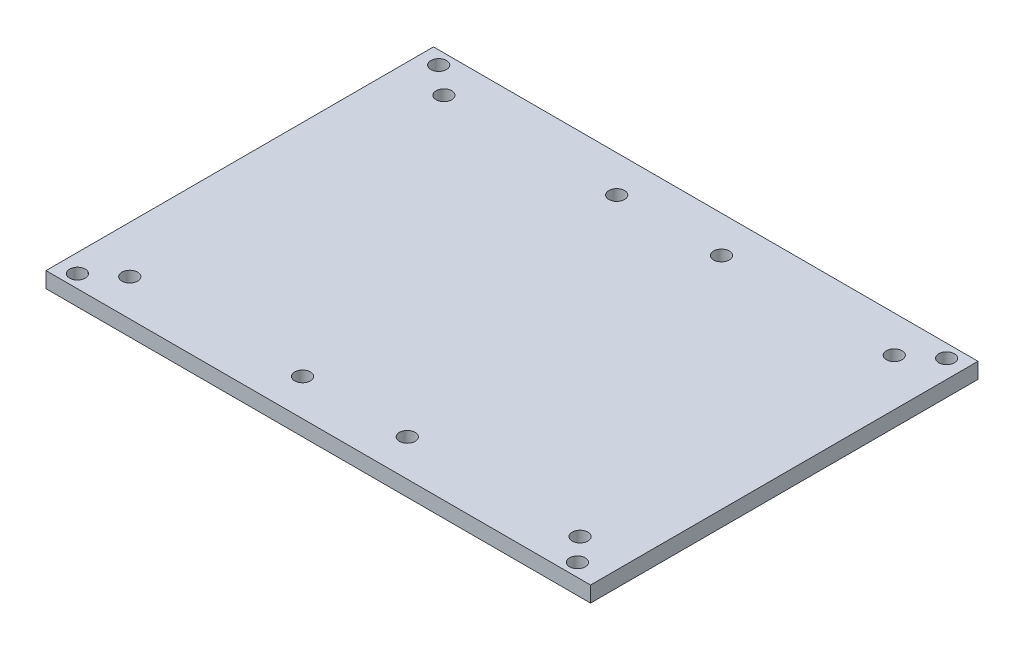
from build123d import *

# Parameters (mm, degrees)
SKETCH_1_W            = 104
SKETCH_1_H            = 74
EXTRUDE_203_DEPTH     = 3
SKETCH_2_R            = 1.5
CUT_EXTRUDE_441_DEPTH = 64.89053138


with BuildPart() as part:
    # 草图1 → Extrude 203 (new body)
    with BuildSketch(Plane(origin=(0, 0, 0), x_dir=(1, 0, 0), z_dir=(0, 1, 0))):
        Rectangle(SKETCH_1_W, SKETCH_1_H)
    extrude(amount=EXTRUDE_203_DEPTH)

    # 草图2 → Cut-Extrude 441 (cut, through all)
    with BuildSketch(Plane(origin=(0, 3, 0), x_dir=(1, 0, 0), z_dir=(0, 1, 0))):
        with Locations(Location((-43, 30, 0), (0, 0, 270))):
            Circle(SKETCH_2_R)
        with Locations(Location((-43, -30, 0), (0, 0, 270))):
            Circle(SKETCH_2_R)
        with Locations(Location((-10, 30, 0), (0, 0, 270))):
            Circle(SKETCH_2_R)
        with Locations(Location((-10, -30, 0), (0, 0, 270))):
            Circle(SKETCH_2_R)
        with Locations(Location((10, 30, 0), (0, 0, 270))):
            Circle(SKETCH_2_R)
        with Locations(Location((10, -30, 0), (0, 0, 270))):
            Circle(SKETCH_2_R)
        with Locations(Location((43, 30, 0), (0, 0, 270))):
            Circle(SKETCH_2_R)
        with Locations(Location((43, -30, 0), (0, 0, 270))):
            Circle(SKETCH_2_R)
        with Locations(Location((48.5, 34.5, 0), (0, 0, 270))):
            Circle(SKETCH_2_R)
        with Locations(Location((-48.5, 34.5, 0), (0, 0, 270))):
            Circle(SKETCH_2_R)
        with Locations(Location((-48.5, -34.5, 0), (0, 0, 270))):
            Circle(SKETCH_2_R)
        with Locations(Location((47, -34.5, 0), (0, 0, 270))):
            Circle(SKETCH_2_R)
    extrude(amount=-CUT_EXTRUDE_441_DEPTH, mode=Mode.SUBTRACT)


solid = part.part
